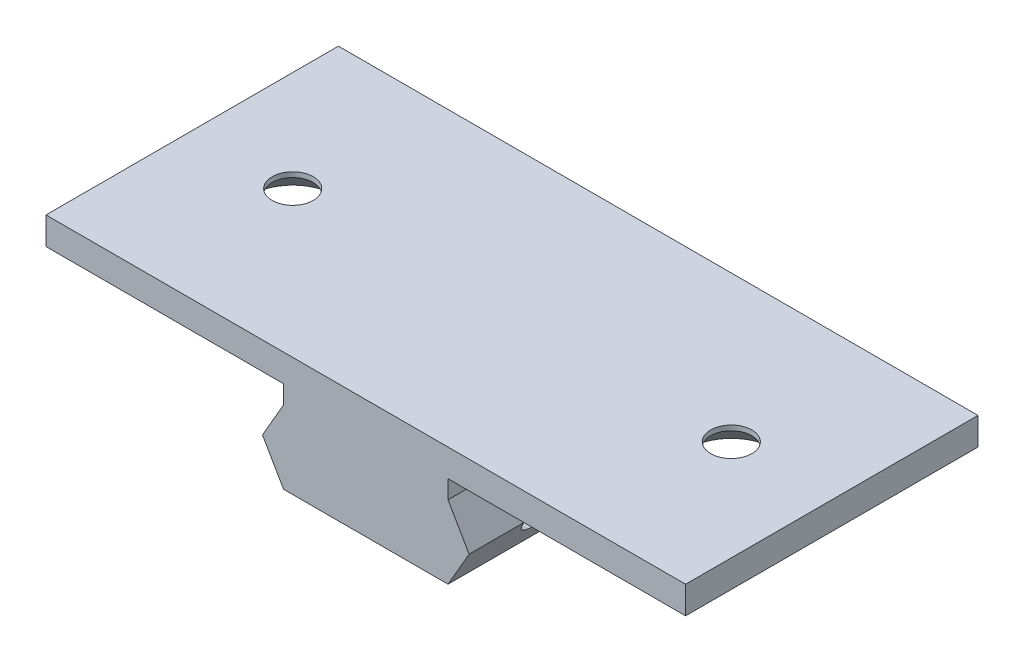
from build123d import *

# Parameters (mm, degrees)
BOSS_EXTRUDE1_DEPTH                          = 32
SKETCH2_R                                    = 2
CUT_EXTRUDE1_DEPTH                           = 35.869794274
LPATTERN1_COUNT                              = 3
LPATTERN1_PITCH                              = 8
BOSS_EXTRUDE2_DEPTH                          = 9
BOSS_EXTRUDE2_DEPTH_BACK                     = 9
SKETCH3_W                                    = 32
SKETCH3_H                                    = 2
BOSS_EXTRUDE3_DEPTH                          = 35
BOSS_EXTRUDE3_DEPTH_BACK                     = 35
SKETCH4_W                                    = 32
SKETCH4_H                                    = 3
CSK_FOR_M4_COUNTERSUNK_FLAT_HEAD_SCR_2_COUNT = 2
CSK_FOR_M4_COUNTERSUNK_FLAT_HEAD_SCR_2_PITCH = 48


with BuildPart() as part:
    # Sketch1 → Boss-Extrude1 (new body)
    with BuildSketch(Plane.XY):
        Polygon((9, 0), (-9, 0), (-11.309401077, 4), (-9, 8), (9, 8), (11.309401077, 4), align=None)
    extrude(amount=BOSS_EXTRUDE1_DEPTH)

    # Sketch2 → Cut-Extrude1 (cut, symmetric)
    with BuildSketch(Plane(origin=(0, 0, 0), x_dir=(0, 0, -1), z_dir=(1, 0, 0))):
        with Locations((-24, 4)):
            Circle(SKETCH2_R)
    cut_extrude1 = extrude(amount=CUT_EXTRUDE1_DEPTH, both=True, mode=Mode.SUBTRACT)

    # LPattern1: Cut-Extrude1 ×3
    with Locations(*[(0, 0, -i * LPATTERN1_PITCH) for i in range(1, LPATTERN1_COUNT)]):
        add(cut_extrude1, mode=Mode.SUBTRACT)

    # Sketch3 → Boss-Extrude2 (add, two sides: drawn at the far end of the back side and taken through both)
    with BuildSketch(Plane(origin=(0, 0, 0), x_dir=(0, 0, -1), z_dir=(1, 0, 0)).offset(-BOSS_EXTRUDE2_DEPTH_BACK)):
        with Locations((-16, 9)):
            Rectangle(SKETCH3_W, SKETCH3_H)
    extrude(amount=BOSS_EXTRUDE2_DEPTH + BOSS_EXTRUDE2_DEPTH_BACK)

    # Sketch4 → Boss-Extrude3 (add, two sides: drawn at the far end of the back side and taken through both)
    with BuildSketch(Plane(origin=(0, 0, 0), x_dir=(0, 0, -1), z_dir=(1, 0, 0)).offset(-BOSS_EXTRUDE3_DEPTH_BACK)):
        with Locations((-16, 11.5)):
            Rectangle(SKETCH4_W, SKETCH4_H)
    extrude(amount=BOSS_EXTRUDE3_DEPTH + BOSS_EXTRUDE3_DEPTH_BACK)

    # Skizze3 → CSK for M4 Countersunk Flat Head Screw1 (revolve, cut)
    with BuildSketch(Plane(origin=(24, 10, 16), x_dir=(0, 0, -1), z_dir=(1, 0, 0))):
        Polygon((0, 0), (0, 3), (2.25, 3), (2.25, 2.45), (4.7, 0), align=None)
    csk_for_m4_countersunk_flat_head_screw1 = revolve(axis=Axis((24, 3.65, 16), (0, 1, 0)), mode=Mode.SUBTRACT)

    # CSK for M4 Countersunk Flat Head Scr 2: CSK for M4 Countersunk Flat Head Screw1 ×2
    with Locations(*[(-i * CSK_FOR_M4_COUNTERSUNK_FLAT_HEAD_SCR_2_PITCH, 0, 0) for i in range(1, CSK_FOR_M4_COUNTERSUNK_FLAT_HEAD_SCR_2_COUNT)]):
        add(csk_for_m4_countersunk_flat_head_screw1, mode=Mode.SUBTRACT)


solid = part.part
